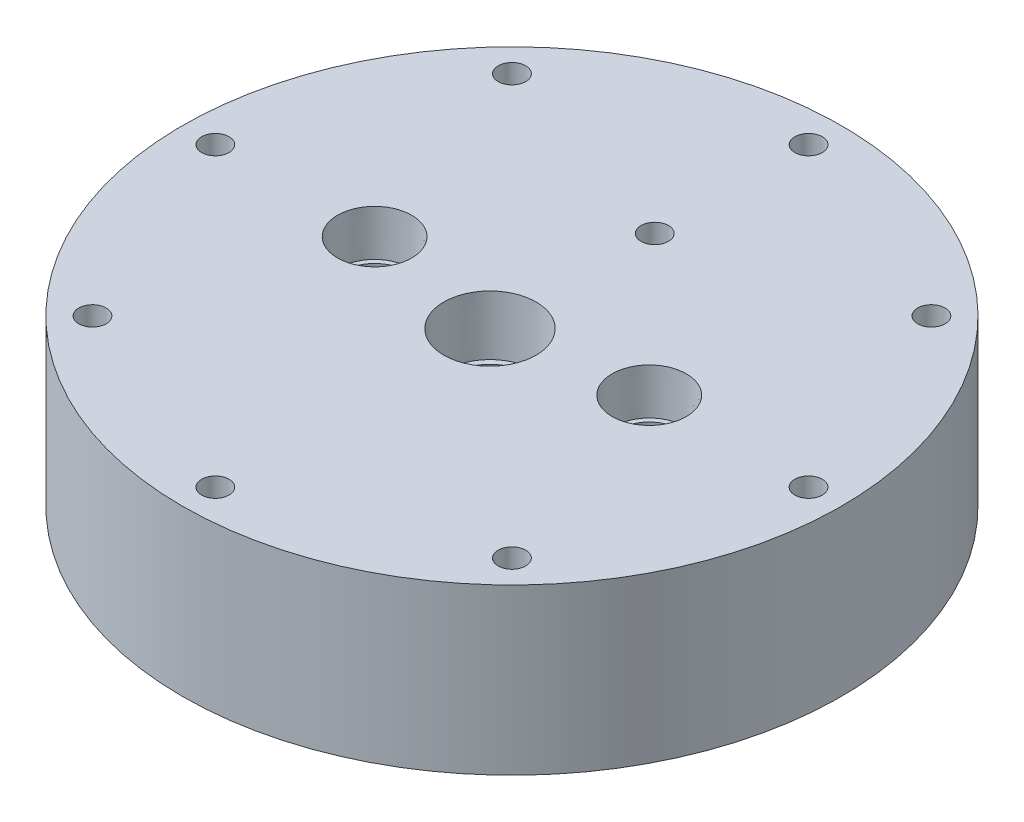
from build123d import *

# Parameters (mm, degrees)
SKETCH1_R                                      = 76.2
BILLET_DEPTH                                   = 50.8
SKETCH3_R                                      = 19.05
LOX_PLATE_DEPTH                                = 13.97
SKETCH5_R                                      = 13.97
LOX_DOME_DEPTH                                 = 20.32
SKETCH7_R                                      = 76.2
TOP_MILL_DEPTH                                 = 12.7
F_1_4_BOLT_HOLE_REACH                          = 116.3
SKETCH11_R                                     = 3.175
BOLT_PATTERN_COUNT                             = 8
SKETCH12_R                                     = 60.96
KEROSENE_PLATE_DEPTH                           = 10.16
SKETCH26_R                                     = 17.78
SKETCH26_R_2                                   = 16.51
LOX_PLATE_O_RING_DEPTH                         = 1.27
KEROSENE_INLET_3_8_NPT_TAPPED_HOLE1_AT_2_COUNT = 2
KEROSENE_INLET_3_8_NPT_TAPPED_HOLE1_AT_2_PITCH = 63.5
MANIFOLD_HOLE_REACH                            = 121.137
SKETCH14_R                                     = 3.175
SKETCH15_R                                     = 8.89
SKETCH15_R_2                                   = 7.62
MANIFOLD_SEAL_DEPTH                            = 1.27


with BuildPart() as part:
    # Sketch1 → Billet (new body)
    with BuildSketch(Plane(origin=(0, 0, 0), x_dir=(1, 0, 0), z_dir=(0, 1, 0))):
        Circle(SKETCH1_R)
    extrude(amount=-BILLET_DEPTH)

    # Sketch3 → Lox Plate (cut)
    with BuildSketch(Plane(origin=(0, -50.8, 0), x_dir=(1, 0, 0), z_dir=(0, 1, 0))):
        with Locations((0, -5.08)):
            Circle(SKETCH3_R)
    extrude(amount=LOX_PLATE_DEPTH, mode=Mode.SUBTRACT)

    # Sketch5 → Lox Dome (cut)
    with BuildSketch(Plane(origin=(0, -50.8, 0), x_dir=(1, 0, 0), z_dir=(0, 1, 0))):
        with Locations((0, -5.08)):
            Circle(SKETCH5_R)
    extrude(amount=LOX_DOME_DEPTH, mode=Mode.SUBTRACT)

    # Sketch7 → Top Mill (cut)
    with BuildSketch(Plane(origin=(0, 0, 0), x_dir=(1, 0, 0), z_dir=(0, 1, 0))):
        Circle(SKETCH7_R)
    extrude(amount=-TOP_MILL_DEPTH, mode=Mode.SUBTRACT)

    # Sketch11 → 1/4" Bolt Hole (cut, up to next)
    with BuildSketch(Plane(origin=(0, -50.8, 0), x_dir=(1, 0, 0), z_dir=(0, 1, 0)), mode=Mode.PRIVATE) as f_1_4_bolt_hole_sk1:
        with Locations((0, 68.58)):
            Circle(SKETCH11_R)
    f_1_4_bolt_hole_tool1 = extrude(f_1_4_bolt_hole_sk1.sketch, amount=F_1_4_BOLT_HOLE_REACH, mode=Mode.PRIVATE) & part.part
    f_1_4_bolt_hole = f_1_4_bolt_hole_tool1.solids().sort_by_distance((0, -50.8, -68.58))[0]
    add(f_1_4_bolt_hole, mode=Mode.SUBTRACT)

    # Bolt Pattern: 1/4" Bolt Hole ×8 about axis
    bolt_pattern_axis = Axis((0, 53.34, 0), (0, -1, 0))
    for i in range(1, BOLT_PATTERN_COUNT):
        add(f_1_4_bolt_hole.rotate(bolt_pattern_axis, i * 360 / BOLT_PATTERN_COUNT), mode=Mode.SUBTRACT)

    # Sketch12 → Kerosene Plate (cut)
    with BuildSketch(Plane(origin=(0, -50.8, 0), x_dir=(1, 0, 0), z_dir=(0, 1, 0))):
        Circle(SKETCH12_R)
    extrude(amount=KEROSENE_PLATE_DEPTH, mode=Mode.SUBTRACT)

    # Sketch21 → Lox Inlet-1/2 NPT Tapped Hole3 (revolve, cut)
    with BuildSketch(Plane(origin=(0, -12.7, 5.08), x_dir=(0, 0, 1), z_dir=(1, 0, 0))):
        Polygon((0, 0), (0, 38.1), (8.9281, 38.1), (8.9281, 13.462), (10.261665792, 13.462), (10.6647361, 0), align=None)
    revolve(axis=Axis((0, -6.35, 5.08), (0, -1, 0)), mode=Mode.SUBTRACT)

    # Sketch26 → Lox Plate O Ring (cut)
    with BuildSketch(Plane.XZ.offset(36.83)):
        with Locations((0, 5.08)):
            Circle(SKETCH26_R)
        with Locations((0, 5.08)):
            Circle(SKETCH26_R_2, mode=Mode.SUBTRACT)
    extrude(amount=-LOX_PLATE_O_RING_DEPTH, mode=Mode.SUBTRACT)

    # Sketch25 → Kerosene Inlet-3/8 NPT Tapped Hole1 (revolve, cut)
    with BuildSketch(Plane(origin=(-31.75, -12.7, 0), x_dir=(0, 0, 1), z_dir=(1, 0, 0))):
        Polygon((0, 0), (0, 38.1), (7.1374, 38.1), (7.1374, 10.414), (8.263205494, 10.414), (8.5750146, 0), align=None)
    kerosene_inlet_3_8_npt_tapped_hole1 = revolve(axis=Axis((-31.75, -6.35, 0), (0, -1, 0)), mode=Mode.SUBTRACT)

    # Kerosene Inlet-3/8 NPT Tapped Hole1 at 2: Kerosene Inlet-3/8 NPT Tapped Hole1 ×2
    with Locations(*[(i * KEROSENE_INLET_3_8_NPT_TAPPED_HOLE1_AT_2_PITCH, 0, 0) for i in range(1, KEROSENE_INLET_3_8_NPT_TAPPED_HOLE1_AT_2_COUNT)]):
        add(kerosene_inlet_3_8_npt_tapped_hole1, mode=Mode.SUBTRACT)

    # Sketch14 → Manifold hole (cut, up to next)
    with BuildSketch(Plane(origin=(0, 0, 0), x_dir=(1, 0, 0), z_dir=(0, 1, 0)), mode=Mode.PRIVATE) as manifold_hole_sk1:
        with Locations((0, 33.02)):
            Circle(SKETCH14_R)
    manifold_hole_tool1 = extrude(manifold_hole_sk1.sketch, amount=-MANIFOLD_HOLE_REACH, mode=Mode.PRIVATE) & part.part
    add(manifold_hole_tool1.solids().sort_by_distance((0, 0, -33.02))[0], mode=Mode.SUBTRACT)

    # Sketch15 → Manifold seal (cut)
    with BuildSketch(Plane(origin=(0, -40.64, 0), x_dir=(1, 0, 0), z_dir=(0, 1, 0))):
        with Locations((0, 33.02)):
            Circle(SKETCH15_R)
        with Locations((0, 33.02)):
            Circle(SKETCH15_R_2, mode=Mode.SUBTRACT)
    extrude(amount=MANIFOLD_SEAL_DEPTH, mode=Mode.SUBTRACT)


solid = part.part
